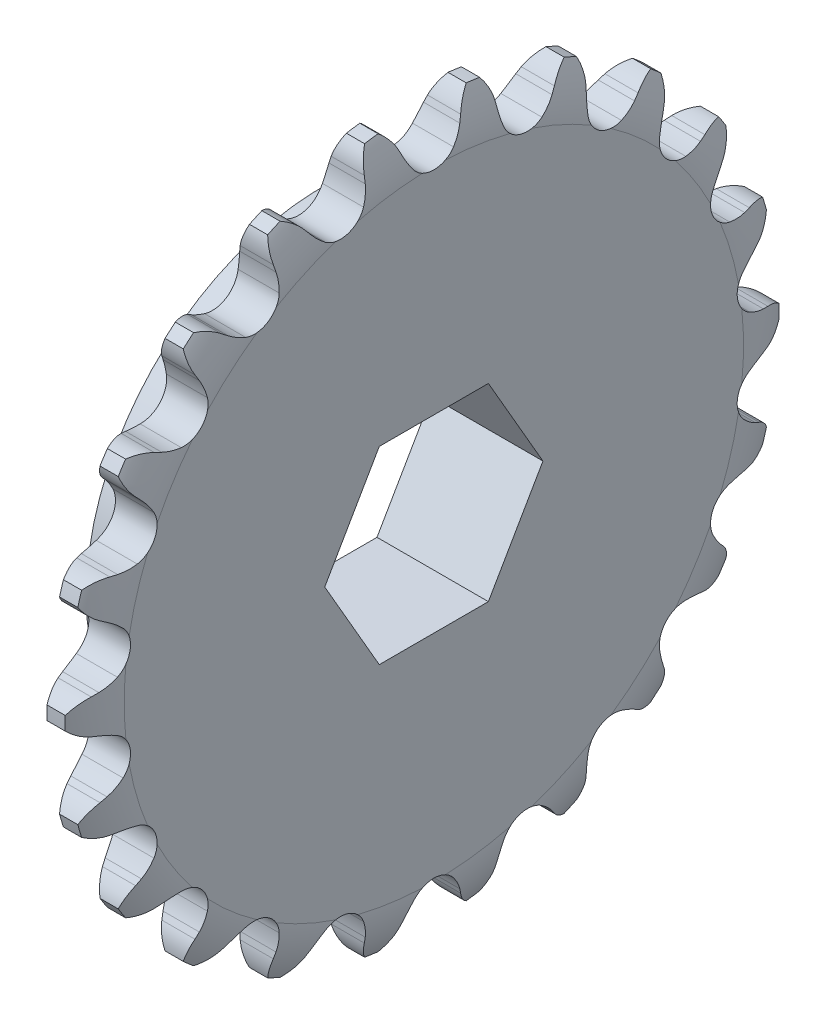
from build123d import *

# Parameters (mm, degrees)
TOOTHCUT_DEPTH     = 35.038989915
TEETHCUTS_COUNT    = 22
TEETHCUTS_ANGLE    = 343.636363636
HUBNEAONESKE_R     = 15.875
HUBNEARONE_DEPTH   = 7.4867008
BORSKE_R           = 4.7625
BORE_DEPTH         = 10.2870508
CUT_EXTRUDE1_DEPTH = 36.325169553
CUT_EXTRUDE2_START = -2.80035
SKETCH2_R          = 15.875
CUT_EXTRUDE2_DEPTH = 2.80035


with BuildPart() as part:
    # BasProSke → Base-Revolve (revolve)
    with BuildSketch(Plane(origin=(0, 0, 0), x_dir=(1, 0, 0), z_dir=(0, 1, 0)), mode=Mode.PRIVATE) as base_revolve_sk:
        with BuildLine():
            Line((0, 0), (0, 20.812610076))
            ThreePointArc((0, 20.812610076), (0.199787117, 22.448200471), (0.7874, 23.987610076))
            Line((0.7874, 23.987610076), (2.01295, 23.987610076))
            ThreePointArc((2.01295, 23.987610076), (2.600562883, 22.448200471), (2.80035, 20.812610076))
            Line((2.80035, 20.812610076), (2.80035, 0))
            Line((2.80035, 0), (0, 0))
        make_face()
    revolve(base_revolve_sk.sketch.rotate(Axis((-10, 0, 0), (1, 0, 0)), 180), axis=Axis((-10, 0, 0), (1, 0, 0)))

    # TooCutSke → ToothCut (cut, through all)
    with BuildSketch(Plane(origin=(0, 0, 0), x_dir=(0, 0, -1), z_dir=(1, 0, 0))):
        with BuildLine():
            Line((1.925899669, 22.281562943), (2.085675584, 22.671665687))
            ThreePointArc((2.085675584, 22.671665687), (3.076365157, 23.886174382), (4.575746562, 24.342630953))
            ThreePointArc((4.575746562, 24.342630953), (0, 24.768955131), (-4.575746562, 24.342630953))
            ThreePointArc((-4.575746562, 24.342630953), (-3.076365157, 23.886174382), (-2.085675584, 22.671665687))
            Line((-2.085675584, 22.671665687), (-1.925899669, 22.281562943))
            ThreePointArc((-1.925899669, 22.281562943), (-1.668318341, 21.756617587), (-1.342492991, 21.271072935))
            ThreePointArc((-1.342492991, 21.271072935), (0, 20.612335557), (1.342492991, 21.271072935))
            ThreePointArc((1.342492991, 21.271072935), (1.668318341, 21.756617587), (1.925899669, 22.281562943))
        make_face()
    toothcut = extrude(amount=TOOTHCUT_DEPTH, mode=Mode.SUBTRACT)

    # TeethCuts: ToothCut ×22 about axis
    teethcuts_axis = Axis((-10, 0, 0), (1, 0, 0))
    for i in range(1, TEETHCUTS_COUNT):
        add(toothcut.rotate(teethcuts_axis, i * TEETHCUTS_ANGLE / (TEETHCUTS_COUNT - 1)), mode=Mode.SUBTRACT)

    # HubNeaOneSke → HubNearOne (add)
    with BuildSketch(Plane.ZY):
        with Locations(Location((0, 0, 0), (0, 0, 180))):
            Circle(HUBNEAONESKE_R)
    extrude(amount=HUBNEARONE_DEPTH)

    # BorSke → Bore (cut, symmetric)
    with BuildSketch(Plane(origin=(0, 0, 0), x_dir=(0, 0, -1), z_dir=(1, 0, 0))):
        with Locations(Location((0, 0, 0), (0, 0, 180))):
            Circle(BORSKE_R)
    extrude(amount=BORE_DEPTH, both=True, mode=Mode.SUBTRACT)

    # Sketch1 → Cut-Extrude1 (cut, through all)
    with BuildSketch(Plane.ZY.offset(7.4867008)):
        Polygon((-7.332348419, 0), (-3.666174209, -6.35), (3.666174209, -6.35), (7.332348419, 0), (3.666174209, 6.35), (-3.666174209, 6.35), align=None)
    extrude(amount=-CUT_EXTRUDE1_DEPTH, mode=Mode.SUBTRACT)

    # Sketch2 → Cut-Extrude2 (cut)
    with BuildSketch(Plane.ZY.offset(7.4867008).offset(CUT_EXTRUDE2_START)):
        with Locations(Location((0, 0, 0), (0, 0, 180))):
            Circle(SKETCH2_R)
    extrude(amount=CUT_EXTRUDE2_DEPTH, mode=Mode.SUBTRACT)


solid = part.part
